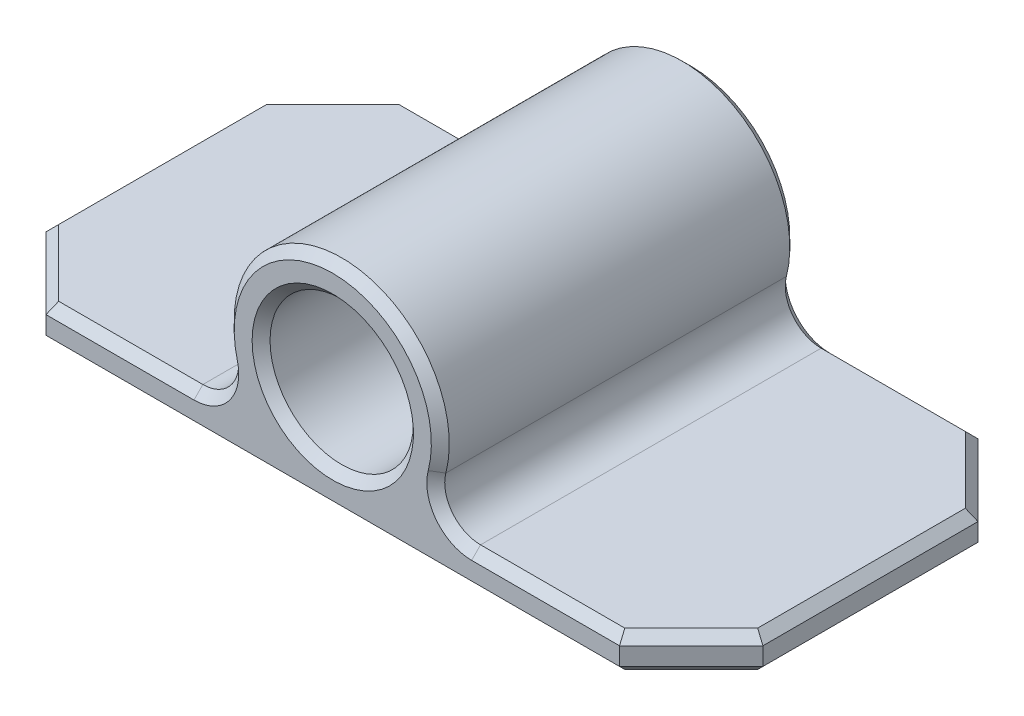
from build123d import *

# Parameters (mm, degrees)
ESQUISSE1_R             = 1
BOSS_EXTRU_1_DEPTH      = 10
ESQUISSE2_R             = 2
ENL_V_MAT_EXTRU_1_DEPTH = 8
CHANFREIN1_SIZE         = 2
CHANFREIN2_SIZE         = 0.25


with BuildPart() as part:
    # Esquisse1 → Boss.-Extru.1 (new body)
    with BuildSketch(Plane.XY):
        with BuildLine():
            Line((-10, -3), (10, -3))
            Line((10, -3), (10, -2))
            Line((10, -2), (3.872983346, -2))
            ThreePointArc((3.872983346, -2), (3.082413931, -1.612372436), (2.90473751, -0.75))
            ThreePointArc((2.90473751, -0.75), (0, 3), (-2.90473751, -0.75))
            ThreePointArc((-2.90473751, -0.75), (-3.082413931, -1.612372436), (-3.872983346, -2))
            Line((-3.872983346, -2), (-10, -2))
            Line((-10, -2), (-10, -3))
        make_face()
        Circle(ESQUISSE1_R, mode=Mode.SUBTRACT)
    extrude(amount=BOSS_EXTRU_1_DEPTH)

    # Esquisse2 → Enlèv. mat.-Extru.1 (cut)
    with BuildSketch(Plane.XY.offset(10)):
        Circle(ESQUISSE2_R)
    extrude(amount=-ENL_V_MAT_EXTRU_1_DEPTH, mode=Mode.SUBTRACT)

    # Chanfrein1
    chanfrein1_edges = [part.edges().sort_by_distance(p)[0] for p in [
        (-10, -2.5, 10),
        (10, -2.5, 10),
        (10, -2.5, 0),
        (-10, -2.5, 0),
    ]]
    chamfer(chanfrein1_edges, length=CHANFREIN1_SIZE)

    # Chanfrein2
    chanfrein2_edges = [part.edges().sort_by_distance(p)[0] for p in [
        (-5.936491673, -2, 0),
        (-3.082413931, -1.612372436, 0),
        (-1, 0, 0),
        (3.082413931, -1.612372436, 10),
        (0, 3, 10),
        (-2, 0, 10),
        (0, -3, 10),
        (5.936491673, -2, 10),
        (0, -3, 0),
        (10, -3, 5),
        (-10, -3, 5),
        (9, -3, 9),
        (9, -3, 1),
        (-9, -3, 1),
        (-9, -3, 9),
        (-10, -2, 5),
        (-3.082413931, -1.612372436, 10),
        (-9, -2, 1),
        (-9, -2, 9),
        (5.936491673, -2, 0),
        (10, -2, 5),
        (9, -2, 9),
        (9, -2, 1),
        (-5.936491673, -2, 10),
        (0, 3, 0),
        (3.082413931, -1.612372436, 0),
    ]]
    chamfer(chanfrein2_edges, length=CHANFREIN2_SIZE)


solid = part.part
